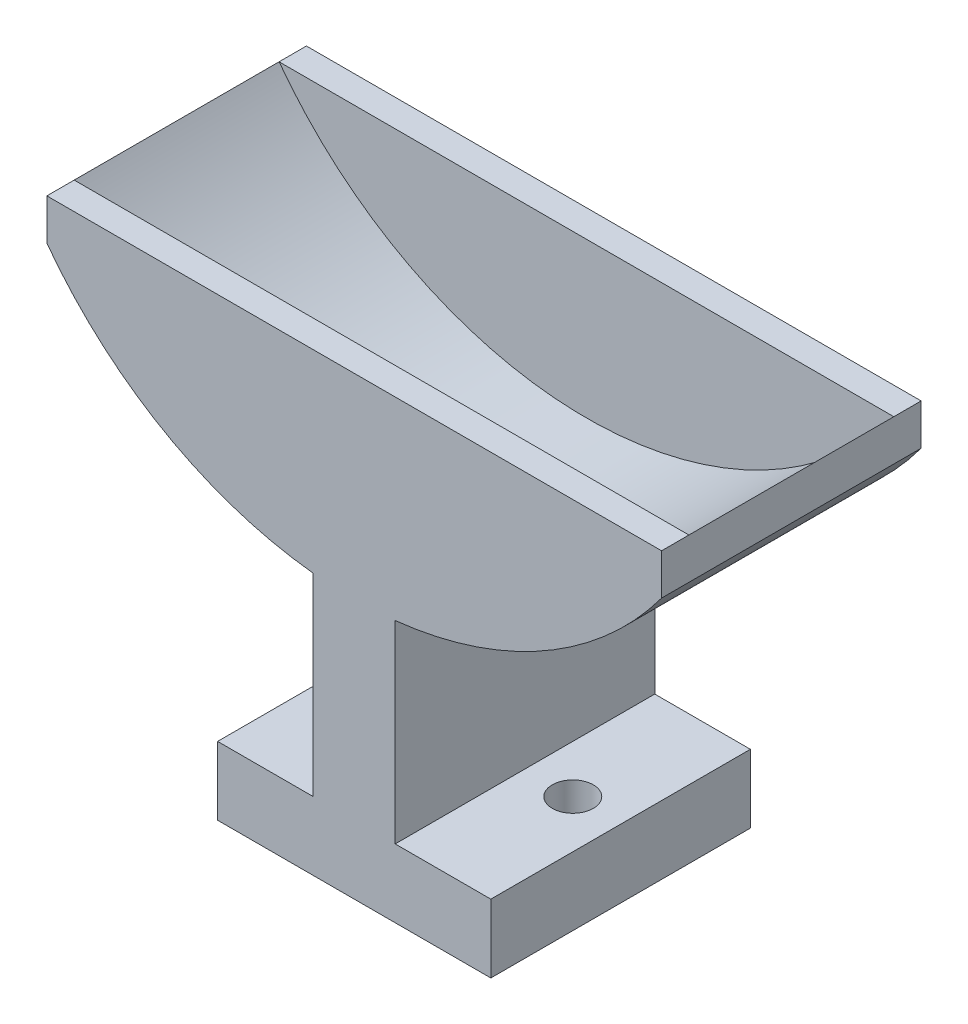
from build123d import *

# Parameters (mm, degrees)
BOSS_EXTRUDE1_DEPTH = 19
BOSS_EXTRUDE2_REACH = 52.283
SKETCH2_W           = 45
SKETCH2_H           = 2
SKETCH3_R           = 1.5
CUT_EXTRUDE1_DEPTH  = 5


with BuildPart() as part:
    # Sketch1 → Boss-Extrude1 (new body)
    with BuildSketch(Plane.XY):
        with BuildLine():
            Line((0, 5), (0, 0))
            Line((0, 0), (20, 0))
            Line((20, 0), (20, 5))
            Line((20, 5), (13, 5))
            Line((13, 5), (13, 19.161178186))
            ThreePointArc((13, 19.161178186), (23.920180244, 22.705379567), (32.5, 30.334166688))
            Line((32.5, 30.334166688), (32.5, 33.334166688))
            ThreePointArc((32.5, 33.334166688), (10, 22), (-12.5, 33.334166688))
            Line((-12.5, 33.334166688), (-12.5, 30.334166688))
            ThreePointArc((-12.5, 30.334166688), (-3.920180244, 22.705379567), (7, 19.161178186))
            Line((7, 19.161178186), (7, 5))
            Line((7, 5), (0, 5))
        make_face()
    extrude(amount=BOSS_EXTRUDE1_DEPTH)

    # Sketch2 → Boss-Extrude2 (add, up to next)
    with BuildSketch(Plane(origin=(0, 33.334166688, 0), x_dir=(1, 0, 0), z_dir=(0, 1, 0)), mode=Mode.PRIVATE) as boss_extrude2_sk1:
        with Locations((10, -18)):
            Rectangle(SKETCH2_W, SKETCH2_H)
    boss_extrude2_tool1 = extrude(boss_extrude2_sk1.sketch, amount=-BOSS_EXTRUDE2_REACH, mode=Mode.PRIVATE) - part.part
    # Sketch2 → Boss-Extrude2 (add, up to next)
    with BuildSketch(Plane(origin=(0, 33.334166688, 0), x_dir=(1, 0, 0), z_dir=(0, 1, 0)), mode=Mode.PRIVATE) as boss_extrude2_sk2:
        with Locations((10, -1)):
            Rectangle(SKETCH2_W, SKETCH2_H)
    boss_extrude2_tool2 = extrude(boss_extrude2_sk2.sketch, amount=-BOSS_EXTRUDE2_REACH, mode=Mode.PRIVATE) - part.part
    add(boss_extrude2_tool1.solids().sort_by_distance((10, 33.334167, 18))[0])
    add(boss_extrude2_tool2.solids().sort_by_distance((10, 33.334167, 1))[0])

    # Sketch3 → Cut-Extrude1 (cut)
    with BuildSketch(Plane(origin=(0, 5, 0), x_dir=(1, 0, 0), z_dir=(0, 1, 0))):
        with Locations(Location((16.5, -9.5, 0), (0, 0, 180))):
            Circle(SKETCH3_R)
        with Locations(Location((3.5, -9.5, 0), (0, 0, 270))):
            Circle(SKETCH3_R)
    extrude(amount=-CUT_EXTRUDE1_DEPTH, mode=Mode.SUBTRACT)


solid = part.part
